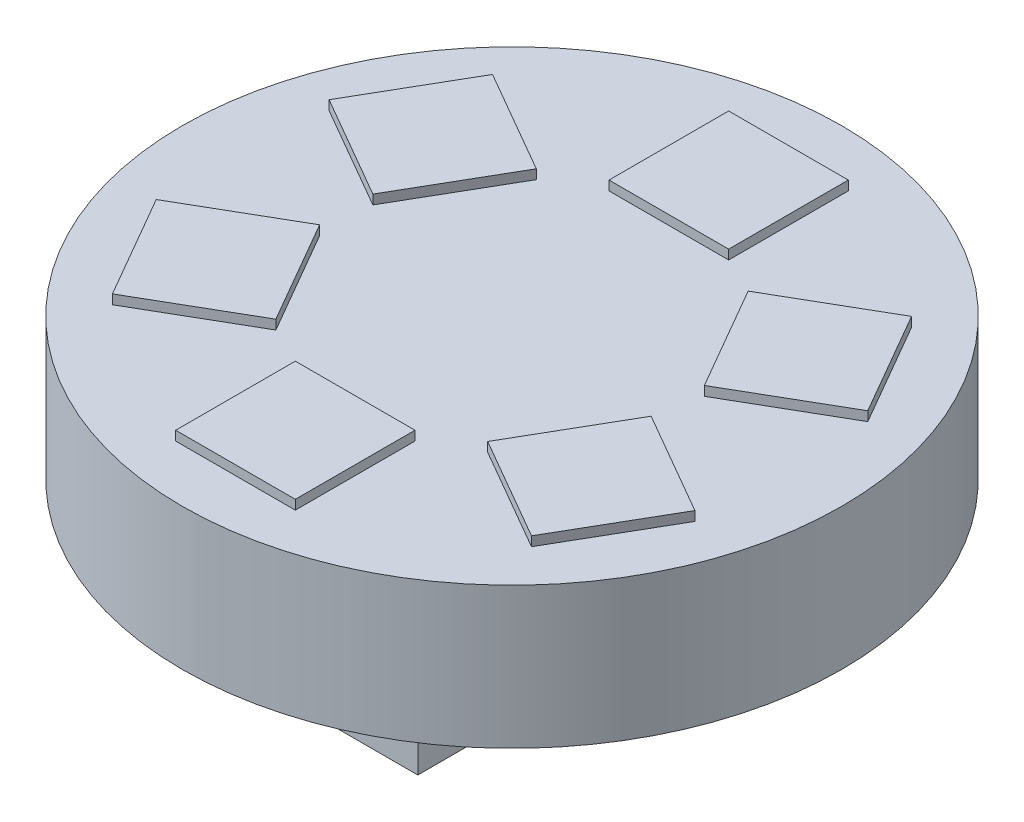
from build123d import *

# Parameters (mm, degrees)
SKETCH1_R           = 3.5
BOSS_EXTRUDE1_DEPTH = 1.5
SKETCH1_3_W         = 2.44
SKETCH1_3_H         = 4.44
BOSS_EXTRUDE2_DEPTH = 1
SKETCH2_W           = 1.27
SKETCH2_H           = 1.27
BOSS_EXTRUDE3_DEPTH = 0.1


with BuildPart() as part:
    # Sketch1 → Boss-Extrude1 (new body)
    with BuildSketch(Plane(origin=(0, 0, 0), x_dir=(1, 0, 0), z_dir=(0, 1, 0))):
        Circle(SKETCH1_R)
    extrude(amount=BOSS_EXTRUDE1_DEPTH)

    # Sketch1<3> → Boss-Extrude2 (add)
    with BuildSketch(Plane(origin=(0, 0, 0), x_dir=(1, 0, 0), z_dir=(0, 1, 0))):
        Rectangle(SKETCH1_3_W, SKETCH1_3_H)
    extrude(amount=-BOSS_EXTRUDE2_DEPTH)

    # Sketch2 → Boss-Extrude3 (add)
    with BuildSketch(Plane(origin=(0, 1.5, 0), x_dir=(1, 0, 0), z_dir=(0, 1, 0))):
        with Locations((0, 2.3)):
            Rectangle(SKETCH2_W, SKETCH2_H)
        Polygon((2.85928456, 0.917573869), (2.22428456, 2.017426131), (1.124432297, 1.382426131), (1.759432297, 0.282573869), align=None)
        Polygon((2.22428456, -2.017426131), (2.85928456, -0.917573869), (1.759432297, -0.282573869), (1.124432297, -1.382426131), align=None)
        with Locations((0, -2.3)):
            Rectangle(SKETCH2_W, SKETCH2_H)
        Polygon((-2.85928456, -0.917573869), (-2.22428456, -2.017426131), (-1.124432297, -1.382426131), (-1.759432297, -0.282573869), align=None)
        Polygon((-2.22428456, 2.017426131), (-2.85928456, 0.917573869), (-1.759432297, 0.282573869), (-1.124432297, 1.382426131), align=None)
    extrude(amount=BOSS_EXTRUDE3_DEPTH)


solid = part.part
